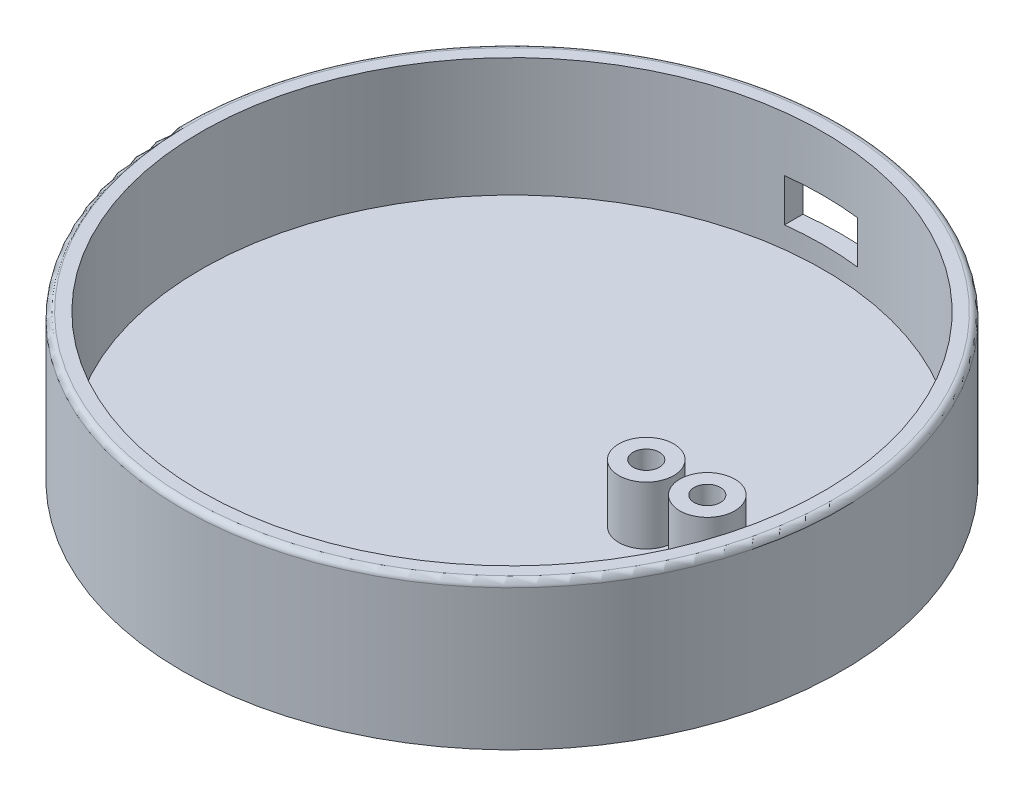
from build123d import *

# Parameters (mm, degrees)
SKETCH_1_R                           = 54
FLOOR_D108_T4P5_DEPTH                = 4.5
SKETCH_2_R                           = 54
SKETCH_2_R_2                         = 51
RIM_OD108_ID102_H24_DEPTH            = 24
SKETCH_3_R                           = 4.5
SENSOR_FIXED_POSTS_DEPTH             = 14
SKETCH_4_R                           = 2.15
M4_FIXED_MOUNT_CLEARANCE_DEPTH       = 14
SKETCH_5_R                           = 4.5
M4_FIXED_HEAD_RECESS_D8P2_T2P7_DEPTH = 2.7
SKETCH_6_W                           = 12
SKETCH_6_H                           = 11
USB_C_SIDE_OPENING_12X7_DEPTH        = 7
BASE_OUTER_ROUND_R1_R                = 1


with BuildPart() as part:
    # 草图1 → Floor_D108_T4p5 (new body)
    with BuildSketch(Plane(origin=(0, 0, 0), x_dir=(1, 0, 0), z_dir=(0, 1, 0))):
        with Locations(Location((0, 0, 0), (0, 0, 270))):
            Circle(SKETCH_1_R)
    extrude(amount=FLOOR_D108_T4P5_DEPTH)

    # 草图2 → Rim_OD108_ID102_H24 (add)
    with BuildSketch(Plane(origin=(0, 0, 0), x_dir=(1, 0, 0), z_dir=(0, 1, 0))):
        with Locations(Location((0, 0, 0), (0, 0, 270))):
            Circle(SKETCH_2_R)
        with Locations(Location((0, 0, 0), (0, 0, 270))):
            Circle(SKETCH_2_R_2, mode=Mode.SUBTRACT)
    extrude(amount=RIM_OD108_ID102_H24_DEPTH)

    # 草图3 → Sensor_fixed_posts (add)
    with BuildSketch(Plane(origin=(0, 0, 0), x_dir=(1, 0, 0), z_dir=(0, 1, 0))):
        with Locations(Location((22, 0, 0), (0, 0, 270))):
            Circle(SKETCH_3_R)
        with Locations(Location((32, 0, 0), (0, 0, 270))):
            Circle(SKETCH_3_R)
    extrude(amount=SENSOR_FIXED_POSTS_DEPTH)

    # 草图4 → M4_fixed_mount_clearance (cut)
    with BuildSketch(Plane(origin=(0, 0, 0), x_dir=(1, 0, 0), z_dir=(0, 1, 0))):
        with Locations(Location((22, 0, 0), (0, 0, 270))):
            Circle(SKETCH_4_R)
        with Locations(Location((32, 0, 0), (0, 0, 270))):
            Circle(SKETCH_4_R)
    extrude(amount=M4_FIXED_MOUNT_CLEARANCE_DEPTH, mode=Mode.SUBTRACT)

    # 草图5 → M4_fixed_head_recess_D8p2_T2p7 (cut)
    with BuildSketch(Plane(origin=(0, 0, 0), x_dir=(1, 0, 0), z_dir=(0, 1, 0))):
        with Locations(Location((22, 0, 0), (0, 0, 270))):
            Circle(SKETCH_5_R)
        with Locations(Location((32, 0, 0), (0, 0, 270))):
            Circle(SKETCH_5_R)
    extrude(amount=M4_FIXED_HEAD_RECESS_D8P2_T2P7_DEPTH, mode=Mode.SUBTRACT)

    # 草图6 → USB_C_side_opening_12x7 (cut)
    with BuildSketch(Plane(origin=(0, 8, 0), x_dir=(1, 0, 0), z_dir=(0, 1, 0))):
        with Locations((0, 54.5)):
            Rectangle(SKETCH_6_W, SKETCH_6_H)
    extrude(amount=USB_C_SIDE_OPENING_12X7_DEPTH, mode=Mode.SUBTRACT)

    # Base_outer_round_R1
    base_outer_round_r1_edges = [part.edges().sort_by_distance(p)[0] for p in [
        (0, 24, -54),
    ]]
    fillet(base_outer_round_r1_edges, radius=BASE_OUTER_ROUND_R1_R)


solid = part.part
